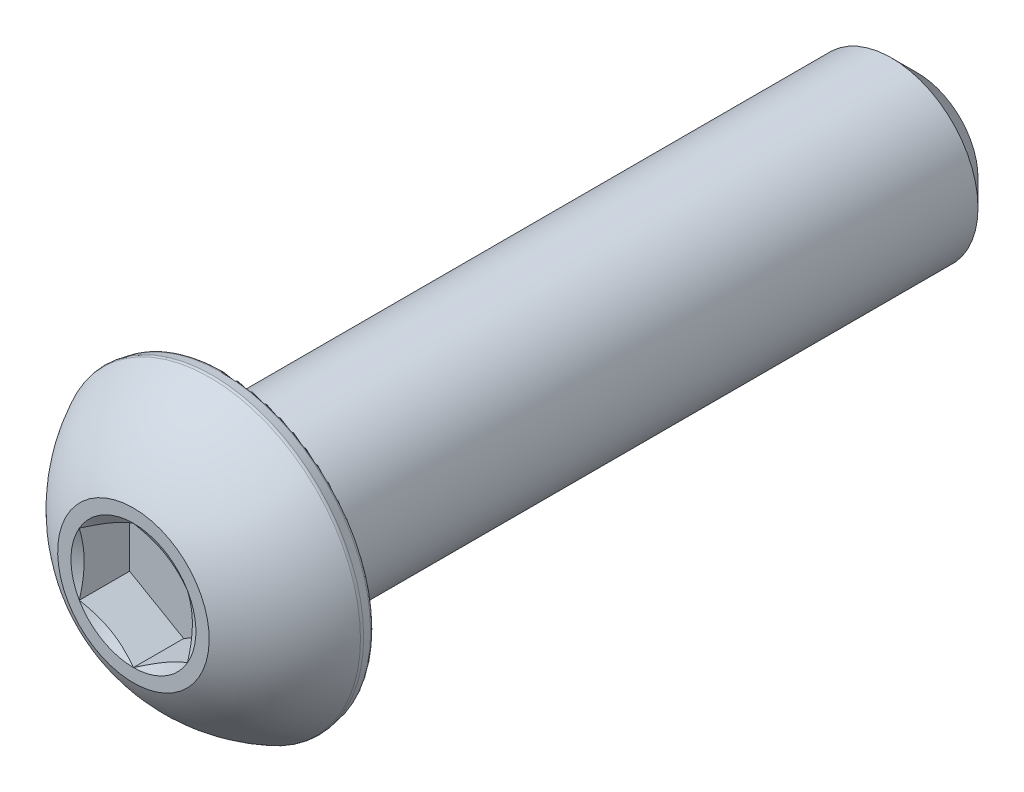
from build123d import *

# Parameters (mm, degrees)
CUT_EXTRUDE1_DEPTH = 1.84404
FILLET1_R          = 0.16764


with BuildPart() as part:
    # Sketch3 → Revolve1 (revolve)
    with BuildSketch(Plane(origin=(0, 0, 0), x_dir=(0, 0, -1), z_dir=(1, 0, 0)), mode=Mode.PRIVATE) as revolve1_sk:
        with BuildLine():
            Line((-14.3764, 0), (-14.3764, 2.778125))
            ThreePointArc((-14.3764, 2.778125), (-13.182024687, 4.401074199), (-11.52652, 5.5499))
            Line((-11.52652, 5.5499), (-11.0236, 5.461221635))
            Line((-11.0236, 5.461221635), (-11.0236, 3.175))
            Line((-11.0236, 3.175), (13.4239, 3.175))
            Line((13.4239, 3.175), (14.3764, 2.2225))
            Line((14.3764, 2.2225), (14.3764, 0))
            Line((14.3764, 0), (-14.3764, 0))
        make_face()
    revolve(revolve1_sk.sketch.rotate(Axis((0, 0, 14.3764), (0, 0, -1)), 90), axis=Axis((0, 0, 14.3764), (0, 0, -1)))

    # Sketch4 → Cut-Extrude1 (cut)
    with BuildSketch(Plane.XY.offset(14.3764)):
        Polygon((-1.984375, -1.14567944), (0, -2.291358881), (1.984375, -1.14567944), (1.984375, 1.14567944), (0, 2.291358881), (-1.984375, 1.14567944), align=None)
    extrude(amount=-CUT_EXTRUDE1_DEPTH, mode=Mode.SUBTRACT)

    # Cut-Extrude2 cone 1 section (through the dimple's axis) → Cut-Extrude2 (revolve, cut)
    with BuildSketch(Plane(origin=(0, 0, 14.3764), x_dir=(0, -1, 0), z_dir=(1, 0, 0))):
        Polygon((0, 0), (2.291358881, 0), (0, 1.322916667), align=None)
    revolve(axis=Axis((0, 0, 14.3764), (0, 0, -1)), mode=Mode.SUBTRACT)

    # Fillet1
    fillet1_edges = [part.edges().sort_by_distance(p)[0] for p in [
        (-5.461221635, 0, 11.0236),
        (-5.5499, 0, 11.52652),
    ]]
    fillet(fillet1_edges, radius=FILLET1_R)


solid = part.part
